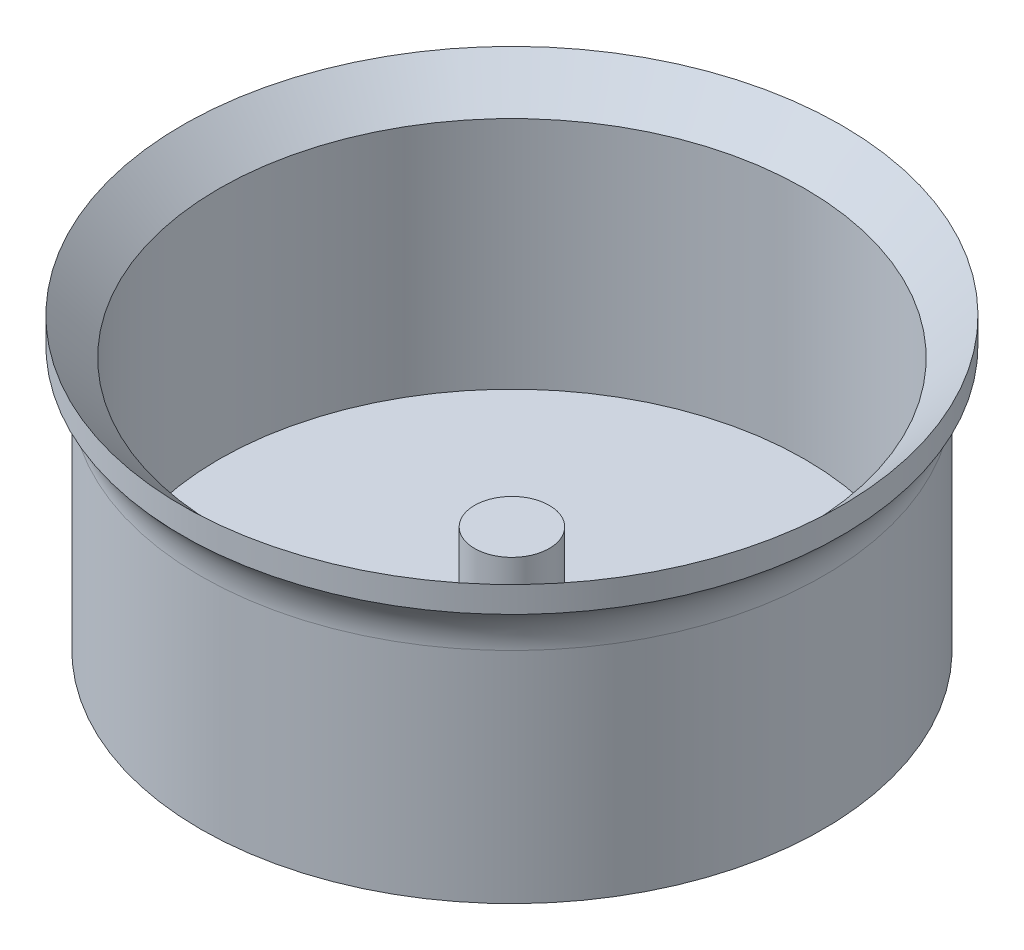
from build123d import *


with BuildPart() as part:
    # Sketch2 → Revolve1 (revolve)
    with BuildSketch(Plane(origin=(0, 0, 0), x_dir=(0, 0, -1), z_dir=(1, 0, 0))):
        with BuildLine():
            Line((0, 0), (0, 9.2075))
            Line((0, 9.2075), (3.2385, 9.2075))
            Line((3.2385, 9.2075), (3.2385, 1.5875))
            Line((3.2385, 1.5875), (25.4, 1.5875))
            Line((25.4, 1.5875), (25.4, 21.9075))
            Line((25.4, 21.9075), (28.575, 25.0825))
            Line((28.575, 25.0825), (28.575, 22.83743597))
            ThreePointArc((28.575, 22.83743597), (27.400077808, 21.079040646), (26.9875, 19.004871939))
            Line((26.9875, 19.004871939), (26.9875, 0))
            Line((26.9875, 0), (0, 0))
        make_face()
    revolve(axis=Axis((0, 0, 0), (0, 1, 0)))


solid = part.part
